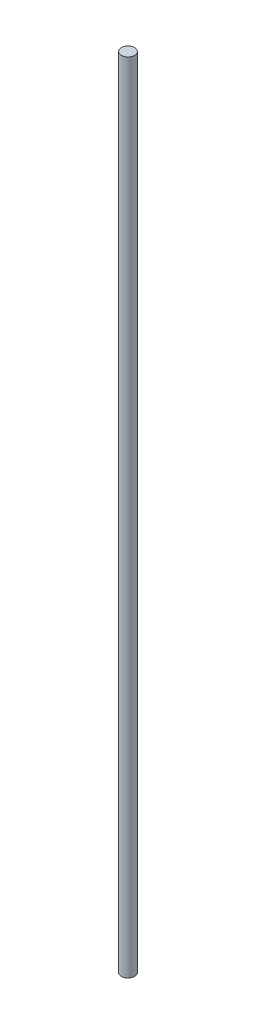
from build123d import *

# Parameters (mm, degrees)
SKETCH1_R           = 1.016
BOSS_EXTRUDE1_DEPTH = 120.65


with BuildPart() as part:
    # Sketch1 → Boss-Extrude1 (new body)
    with BuildSketch(Plane(origin=(0, 0, 0), x_dir=(1, 0, 0), z_dir=(0, 1, 0))):
        with Locations(Location((0, 0, 0), (0, 0, 90))):
            Circle(SKETCH1_R)
    extrude(amount=BOSS_EXTRUDE1_DEPTH)


solid = part.part
